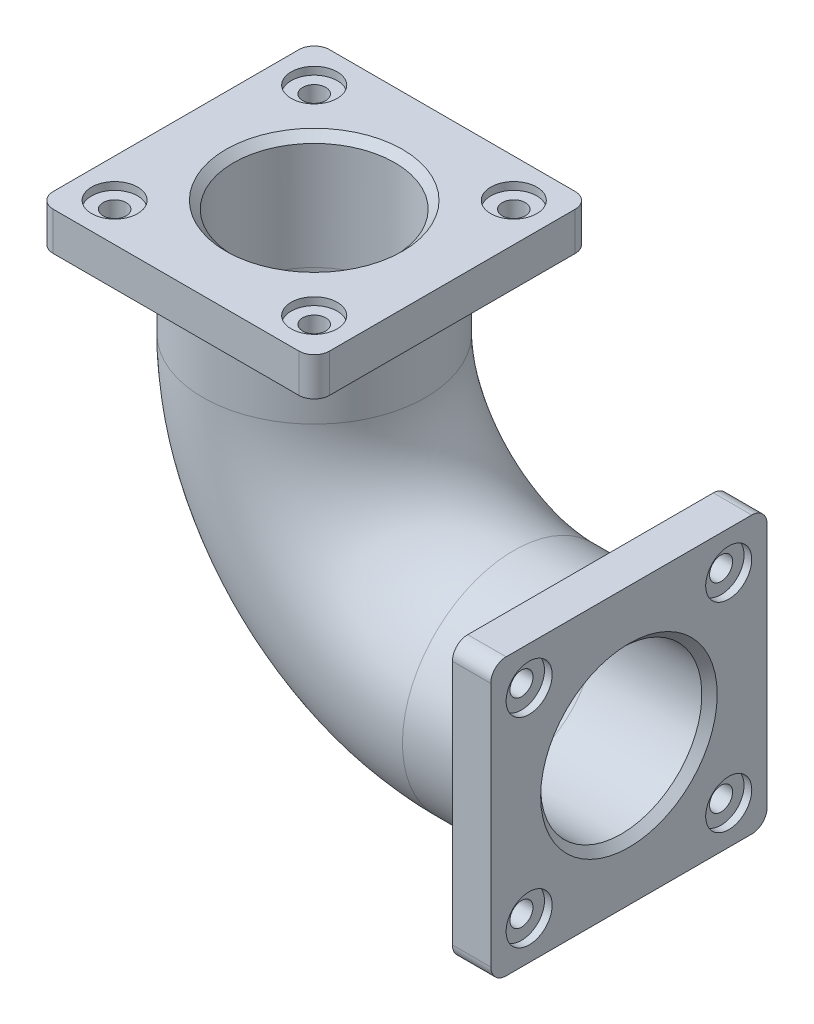
from build123d import *

# Parameters (mm, degrees)
SKETCH2_R           = 145
SKETCH2_R_2         = 105
BOSS_EXTRUDE1_START = -50
SKETCH3_W           = 360
SKETCH3_H           = 360
SKETCH3_R           = 145
BOSS_EXTRUDE1_DEPTH = 50
FILLET1_R           = 20
SKETCH4_W           = 360
SKETCH4_H           = 360
SKETCH4_R           = 145
BOSS_EXTRUDE2_DEPTH = 50
FILLET2_R           = 20
SKETCH5_R           = 30
CUT_EXTRUDE1_DEPTH  = 10
CUT_EXTRUDE2_REACH  = 734.735
SKETCH6_R           = 15
SKETCH7_R           = 30
CUT_EXTRUDE3_DEPTH  = 10
CUT_EXTRUDE4_REACH  = 848.699
SKETCH8_R           = 15
CIRPATTERN1_COUNT   = 4
CHAMFER1_SIZE       = 10
CHAMFER2_SIZE       = 10


with BuildPart() as part:
    # Sweep-Thin1: sweep along a path in Sketch1
    with BuildLine(Plane.XY) as sweep_thin1_path:
        Line((0, 0), (-150, 0))
        ThreePointArc((-150, 0), (-333.847763109, 76.152236891), (-410, 260))
        Line((-410, 260), (-410, 410))
    # Sketch2 → Sweep-Thin1 (sweep)
    with BuildSketch(Plane(origin=(0, 0, 0), x_dir=(0, 0, -1), z_dir=(1, 0, 0))):
        Circle(SKETCH2_R)
        Circle(SKETCH2_R_2, mode=Mode.SUBTRACT)
    sweep(path=sweep_thin1_path.line)

    # Sketch3 → Boss-Extrude1 (add)
    with BuildSketch(Plane(origin=(0, 0, 0), x_dir=(0, 0, -1), z_dir=(1, 0, 0)).offset(BOSS_EXTRUDE1_START)):
        Rectangle(SKETCH3_W, SKETCH3_H)
        Circle(SKETCH3_R, mode=Mode.SUBTRACT)
    extrude(amount=BOSS_EXTRUDE1_DEPTH)

    # Fillet1
    fillet1_edges = [part.edges().sort_by_distance(p)[0] for p in [
        (-25, -180, -180),
        (-25, -180, 180),
        (-25, 180, -180),
        (-25, 180, 180),
    ]]
    fillet(fillet1_edges, radius=FILLET1_R)

    # Sketch4 → Boss-Extrude2 (add)
    with BuildSketch(Plane(origin=(0, 410, 0), x_dir=(1, 0, 0), z_dir=(0, 1, 0))):
        with Locations((-410, 0)):
            Rectangle(SKETCH4_W, SKETCH4_H)
        with Locations((-410, 0)):
            Circle(SKETCH4_R, mode=Mode.SUBTRACT)
    extrude(amount=-BOSS_EXTRUDE2_DEPTH)

    # Fillet2
    fillet2_edges = [part.edges().sort_by_distance(p)[0] for p in [
        (-590, 385, 180),
        (-230, 385, 180),
        (-230, 385, -180),
        (-590, 385, -180),
    ]]
    fillet(fillet2_edges, radius=FILLET2_R)

    # Sketch5 → Cut-Extrude1 (cut)
    with BuildSketch(Plane(origin=(0, 0, 0), x_dir=(0, 0, -1), z_dir=(1, 0, 0))):
        with Locations((-130, 130)):
            Circle(SKETCH5_R)
        with Locations((130, 130)):
            Circle(SKETCH5_R)
        with Locations((-130, -130)):
            Circle(SKETCH5_R)
        with Locations((130, -130)):
            Circle(SKETCH5_R)
    extrude(amount=-CUT_EXTRUDE1_DEPTH, mode=Mode.SUBTRACT)

    # Sketch6 → Cut-Extrude2 (cut, up to next)
    with BuildSketch(Plane(origin=(-10, 0, 0), x_dir=(0, 0, -1), z_dir=(1, 0, 0)), mode=Mode.PRIVATE) as cut_extrude2_sk1:
        with Locations((-130, 130)):
            Circle(SKETCH6_R)
    cut_extrude2_tool1 = extrude(cut_extrude2_sk1.sketch, amount=-CUT_EXTRUDE2_REACH, mode=Mode.PRIVATE) & part.part
    # Sketch6 → Cut-Extrude2 (cut, up to next)
    with BuildSketch(Plane(origin=(-10, 0, 0), x_dir=(0, 0, -1), z_dir=(1, 0, 0)), mode=Mode.PRIVATE) as cut_extrude2_sk2:
        with Locations((130, 130)):
            Circle(SKETCH6_R)
    cut_extrude2_tool2 = extrude(cut_extrude2_sk2.sketch, amount=-CUT_EXTRUDE2_REACH, mode=Mode.PRIVATE) & part.part
    # Sketch6 → Cut-Extrude2 (cut, up to next)
    with BuildSketch(Plane(origin=(-10, 0, 0), x_dir=(0, 0, -1), z_dir=(1, 0, 0)), mode=Mode.PRIVATE) as cut_extrude2_sk3:
        with Locations((130, -130)):
            Circle(SKETCH6_R)
    cut_extrude2_tool3 = extrude(cut_extrude2_sk3.sketch, amount=-CUT_EXTRUDE2_REACH, mode=Mode.PRIVATE) & part.part
    # Sketch6 → Cut-Extrude2 (cut, up to next)
    with BuildSketch(Plane(origin=(-10, 0, 0), x_dir=(0, 0, -1), z_dir=(1, 0, 0)), mode=Mode.PRIVATE) as cut_extrude2_sk4:
        with Locations((-130, -130)):
            Circle(SKETCH6_R)
    cut_extrude2_tool4 = extrude(cut_extrude2_sk4.sketch, amount=-CUT_EXTRUDE2_REACH, mode=Mode.PRIVATE) & part.part
    add(cut_extrude2_tool1.solids().sort_by_distance((-10, 130, 130))[0], mode=Mode.SUBTRACT)
    add(cut_extrude2_tool2.solids().sort_by_distance((-10, 130, -130))[0], mode=Mode.SUBTRACT)
    add(cut_extrude2_tool3.solids().sort_by_distance((-10, -130, -130))[0], mode=Mode.SUBTRACT)
    add(cut_extrude2_tool4.solids().sort_by_distance((-10, -130, 130))[0], mode=Mode.SUBTRACT)

    # Sketch7 → Cut-Extrude3 (cut)
    with BuildSketch(Plane(origin=(0, 410, 0), x_dir=(1, 0, 0), z_dir=(0, 1, 0))):
        with Locations((-540, 130)):
            Circle(SKETCH7_R)
        with Locations((-280, 130)):
            Circle(SKETCH7_R)
        with Locations((-280, -130)):
            Circle(SKETCH7_R)
        with Locations((-540, -130)):
            Circle(SKETCH7_R)
    cut_extrude3 = extrude(amount=-CUT_EXTRUDE3_DEPTH, mode=Mode.SUBTRACT)

    # Sketch8 → Cut-Extrude4 (cut, up to next)
    with BuildSketch(Plane(origin=(0, 400, 0), x_dir=(1, 0, 0), z_dir=(0, 1, 0)), mode=Mode.PRIVATE) as cut_extrude4_sk1:
        with Locations((-540, 130)):
            Circle(SKETCH8_R)
    cut_extrude4_tool1 = extrude(cut_extrude4_sk1.sketch, amount=-CUT_EXTRUDE4_REACH, mode=Mode.PRIVATE) & part.part
    cut_extrude4 = cut_extrude4_tool1.solids().sort_by_distance((-540, 400, -130))[0]
    add(cut_extrude4, mode=Mode.SUBTRACT)

    # CirPattern1: Cut-Extrude3, Cut-Extrude4 ×4 about axis
    cirpattern1_axis = Axis((-410, 260, 0), (0, 1, 0))
    add([cut_extrude3.rotate(cirpattern1_axis, i * 360 / CIRPATTERN1_COUNT) for i in range(1, CIRPATTERN1_COUNT)], mode=Mode.SUBTRACT)
    add([cut_extrude4.rotate(cirpattern1_axis, i * 360 / CIRPATTERN1_COUNT) for i in range(1, CIRPATTERN1_COUNT)], mode=Mode.SUBTRACT)

    # Chamfer1
    chamfer1_edges = [part.edges().sort_by_distance(p)[0] for p in [
        (0, 0, 105),
    ]]
    chamfer(chamfer1_edges, length=CHAMFER1_SIZE)

    # Chamfer2
    chamfer2_edges = [part.edges().sort_by_distance(p)[0] for p in [
        (-410, 410, 105),
    ]]
    chamfer(chamfer2_edges, length=CHAMFER2_SIZE)


solid = part.part
